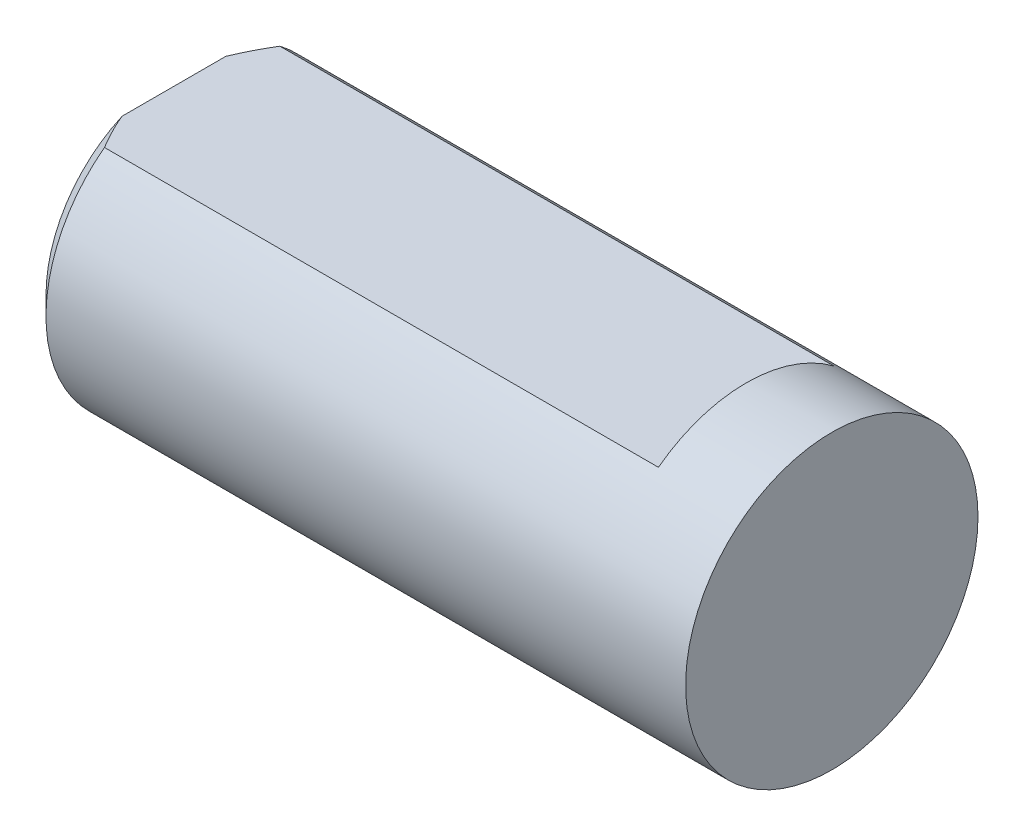
from build123d import *

# Parameters (mm, degrees)
ESQUISSE1_W                  = 18
ESQUISSE1_H                  = 4
CHANFREIN1_SIZE              = 0.5
ENL_V_MAT_EXTRU_1_DEPTH      = 19.867962264
ENL_V_MAT_EXTRU_1_DEPTH_BACK = 19.867962264
ESQUISSE2_W                  = 17.317421693
ESQUISSE2_H                  = 9.702668892


with BuildPart() as part:
    # Esquisse1 → Base-Révolution (revolve)
    with BuildSketch(Plane.XY, mode=Mode.PRIVATE) as base_r_volution_sk:
        with Locations((-9, 2)):
            Rectangle(ESQUISSE1_W, ESQUISSE1_H)
    revolve(base_r_volution_sk.sketch.rotate(Axis((0, 0, 0), (-1, 0, 0)), 90), axis=Axis((0, 0, 0), (-1, 0, 0)))

    # Chanfrein1
    chanfrein1_edges = [part.edges().sort_by_distance(p)[0] for p in [
        (-18, 0, 4),
    ]]
    chamfer(chanfrein1_edges, length=CHANFREIN1_SIZE)

    # Esquisse2 → Enlèv. mat.-Extru.1 (cut, two sides: drawn at the far end of the back side and taken through both)
    with BuildSketch(Plane.XY.offset(-ENL_V_MAT_EXTRU_1_DEPTH_BACK)):
        with Locations((-11.002531853, 8.051334446)):
            Rectangle(ESQUISSE2_W, ESQUISSE2_H)
    extrude(amount=ENL_V_MAT_EXTRU_1_DEPTH + ENL_V_MAT_EXTRU_1_DEPTH_BACK, mode=Mode.SUBTRACT)


solid = part.part
